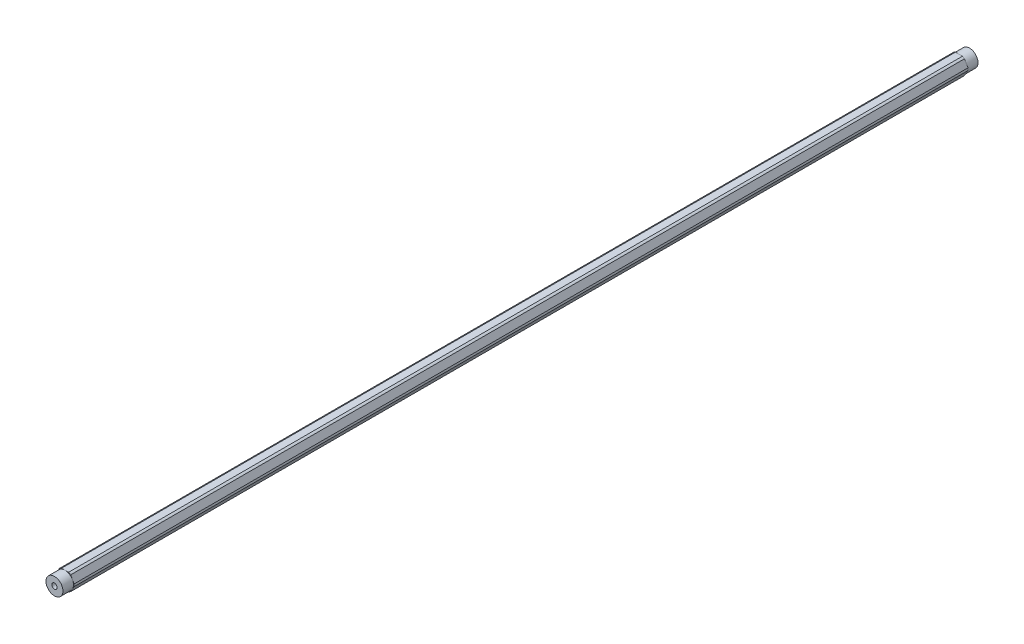
from build123d import *

# Parameters (mm, degrees)
BOSS_EXTRUDE1_DEPTH = 342.9
SKETCH2_OUTSIDE_W   = 153.878
SKETCH2_OUTSIDE_H   = 151.914
SKETCH2_OUTSIDE_R   = 6.35
CUT_EXTRUDE2_DEPTH  = 7.9502
SKETCH3_OUTSIDE_W   = 153.878
SKETCH3_OUTSIDE_H   = 151.914
SKETCH3_OUTSIDE_R   = 6.875
CUT_EXTRUDE4_DEPTH  = 686.868592249
SKETCH4_R           = 2.0193
CUT_EXTRUDE5_DEPTH  = 686.863855386


with BuildPart() as part:
    # Sketch1 → Boss-Extrude1 (new, symmetric)
    with BuildSketch(Plane.XY):
        Polygon((7.332348419, 0), (3.666174209, 6.35), (-3.666174209, 6.35), (-7.332348419, 0), (-3.666174209, -6.35), (3.666174209, -6.35), align=None)
    extrude(amount=BOSS_EXTRUDE1_DEPTH, both=True)

    # Sketch2 outside → Cut-Extrude2 (cut)
    with BuildSketch(Plane.XY.offset(342.9)):
        Rectangle(SKETCH2_OUTSIDE_W, SKETCH2_OUTSIDE_H)
        Circle(SKETCH2_OUTSIDE_R, mode=Mode.SUBTRACT)
    cut_extrude2 = extrude(amount=-CUT_EXTRUDE2_DEPTH, mode=Mode.SUBTRACT)

    # Sketch3 outside → Cut-Extrude4 (cut, through all)
    with BuildSketch(Plane.XY.offset(342.9)):
        Rectangle(SKETCH3_OUTSIDE_W, SKETCH3_OUTSIDE_H)
        Circle(SKETCH3_OUTSIDE_R, mode=Mode.SUBTRACT)
    extrude(amount=-CUT_EXTRUDE4_DEPTH, mode=Mode.SUBTRACT)

    # Mirror1: Cut-Extrude2 across plane
    add(cut_extrude2.mirror(Plane.XY), mode=Mode.SUBTRACT)

    # Sketch4 → Cut-Extrude5 (cut, through all)
    with BuildSketch(Plane.XY.offset(342.9)):
        Circle(SKETCH4_R)
    extrude(amount=-CUT_EXTRUDE5_DEPTH, mode=Mode.SUBTRACT)


solid = part.part
